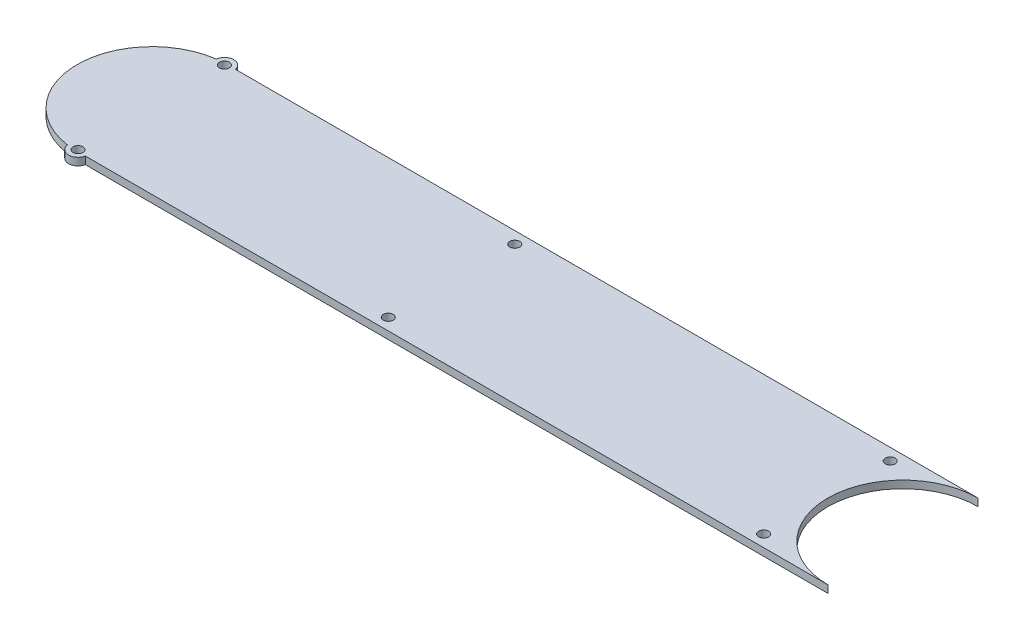
from build123d import *

# Parameters (mm, degrees)
BOSS_EXTRUDE1_DEPTH = 2
SKETCH3_R           = 1.325
CUT_EXTRUDE2_DEPTH  = 3
SKETCH6_R           = 2.5
BOSS_EXTRUDE2_DEPTH = 2
SKETCH7_R           = 1.325
CUT_EXTRUDE3_DEPTH  = 132.863565855


with BuildPart() as part:
    # Sketch1 → Boss-Extrude1 (new body)
    with BuildSketch(Plane(origin=(0, 0, 0), x_dir=(1, 0, 0), z_dir=(0, 1, 0))):
        with BuildLine():
            Line((-110, 20), (90, 20))
            ThreePointArc((90, 20), (70, 0), (90, -20))
            Line((90, -20), (-110, -20))
            ThreePointArc((-110, -20), (-130, 0), (-110, 20))
        make_face()
    extrude(amount=BOSS_EXTRUDE1_DEPTH)

    # Sketch3 → Cut-Extrude2 (cut)
    with BuildSketch(Plane(origin=(0, 2, 0), x_dir=(1, 0, 0), z_dir=(0, 1, 0))):
        with Locations(Location((69.75, -16.85, 0), (0, 0, 270))):
            Circle(SKETCH3_R)
        with Locations(Location((69.75, 16.85, 0), (0, 0, 270))):
            Circle(SKETCH3_R)
        with Locations(Location((-30.25, -16.85, 0), (0, 0, 270))):
            Circle(SKETCH3_R)
        with Locations(Location((-30.25, 16.85, 0), (0, 0, 270))):
            Circle(SKETCH3_R)
    extrude(amount=-CUT_EXTRUDE2_DEPTH, mode=Mode.SUBTRACT)

    # Sketch6 → Boss-Extrude2 (add)
    with BuildSketch(Plane(origin=(0, 2, 0), x_dir=(1, 0, 0), z_dir=(0, 1, 0))):
        with Locations((-110.25, -19.5)):
            Circle(SKETCH6_R)
        with Locations((-110.25, 19.5)):
            Circle(SKETCH6_R)
    extrude(amount=-BOSS_EXTRUDE2_DEPTH)

    # Sketch7 → Cut-Extrude3 (cut, through all)
    with BuildSketch(Plane(origin=(0, 2, 0), x_dir=(1, 0, 0), z_dir=(0, 1, 0))):
        with Locations(Location((-110.25, 19.5, 0), (0, 0, 270))):
            Circle(SKETCH7_R)
        with Locations(Location((-110.25, -19.5, 0), (0, 0, 270))):
            Circle(SKETCH7_R)
    extrude(amount=-CUT_EXTRUDE3_DEPTH, mode=Mode.SUBTRACT)


solid = part.part
